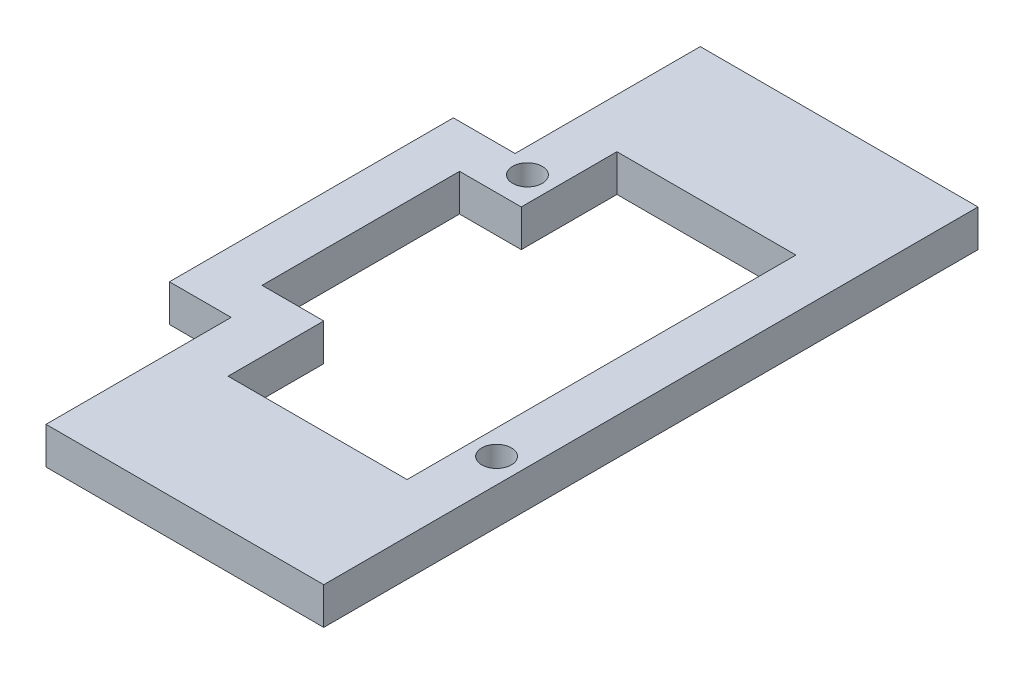
from build123d import *

# Parameters (mm, degrees)
SKETCH_1_R      = 2.4
EXTRUDE_1_DEPTH = 6


with BuildPart() as part:
    # 草图1 → 凸台-拉伸1 (new body)
    # profile 1 of 2: a face of its own
    with BuildSketch(Plane(origin=(0, 0, 0), x_dir=(1, 0, 0), z_dir=(0, 1, 0))):
        Polygon((35.26180856, 66.984800923), (-9.73819144, 66.984800923), (-9.73819144, 36.984800923), (-9.73819144, 29.984800923), (-1.73819144, 29.984800923), (-1.73819144, 45.484800923), (27.26180856, 45.484800923), (27.26180856, -17.515199077), (-1.73819144, -17.515199077), (-1.73819144, -2.015199077), (-9.73819144, -2.015199077), (-9.73819144, -9.015199077), (-9.73819144, -39.015199077), (35.26180856, -39.015199077), align=None)
        with Locations(Location((31.26180856, -7.015199077, 0), (0, 0, 270))):
            Circle(SKETCH_1_R, mode=Mode.SUBTRACT)
        with Locations(Location((-5.73819144, 34.984800923, 0), (0, 0, 270))):
            Circle(SKETCH_1_R, mode=Mode.SUBTRACT)
    # profile 2 of 2: a face of its own
    with BuildSketch(Plane(origin=(0, 0, 0), x_dir=(1, 0, 0), z_dir=(0, 1, 0))):
        Polygon((-9.73819144, 29.984800923), (-9.73819144, 36.984800923), (-19.73819144, 36.984800923), (-19.73819144, -9.015199077), (-9.73819144, -9.015199077), (-9.73819144, -2.015199077), (-11.73819144, -2.015199077), (-11.73819144, 29.984800923), align=None)
    extrude(amount=EXTRUDE_1_DEPTH)


solid = part.part
